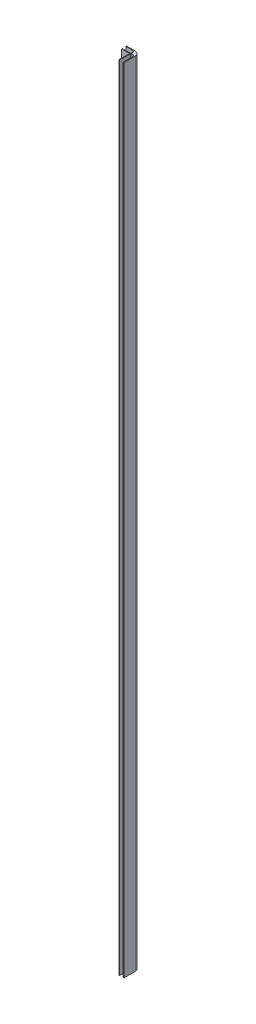
from build123d import *

# Parameters (mm, degrees)
EXTRUDE_1_DEPTH = 1200
FILLET_1_R      = 1


with BuildPart() as part:
    # 草图1 → 凸台-拉伸1 (new body)
    with BuildSketch(Plane(origin=(0, 0, 0), x_dir=(1, 0, 0), z_dir=(0, 1, 0))):
        with BuildLine():
            Line((2.337006084, 17.550433348), (-7.851124943, 17.550433348))
            Line((-7.851124943, 17.550433348), (-7.851124943, 18.550433348))
            Line((-7.851124943, 18.550433348), (5.337006084, 18.550433348))
            ThreePointArc((5.337006084, 18.550433348), (9.933200162, 16.646627425), (11.837006084, 12.050433348))
            Line((11.837006084, 12.050433348), (11.837006084, -5.16889475))
            Line((11.837006084, -5.16889475), (10.837006084, -5.16889475))
            Line((10.837006084, -5.16889475), (10.837006084, 9.050433348))
            ThreePointArc((10.837006084, 9.050433348), (8.861760963, 12.039998533), (5.337006084, 11.395641227))
            Line((5.337006084, 11.395641227), (5.337006084, -5.16889475))
            Line((5.337006084, -5.16889475), (4.337006084, -5.16889475))
            Line((4.337006084, -5.16889475), (4.337006084, 11.050433348))
            Line((4.337006084, 11.050433348), (-7.851124943, 11.050433348))
            Line((-7.851124943, 11.050433348), (-7.851124943, 12.050433348))
            Line((-7.851124943, 12.050433348), (4.682213964, 12.050433348))
            ThreePointArc((4.682213964, 12.050433348), (5.32657127, 15.575188226), (2.337006084, 17.550433348))
        make_face()
    extrude(amount=EXTRUDE_1_DEPTH)

    # 圆角1
    fillet_1_edges = [part.edges().sort_by_distance(p)[0] for p in [
        (4.337006084, 600, -11.050433348),
        (4.682213964, 600, -12.050433348),
        (5.337006084, 600, -11.395641227),
    ]]
    fillet(fillet_1_edges, radius=FILLET_1_R)


solid = part.part
